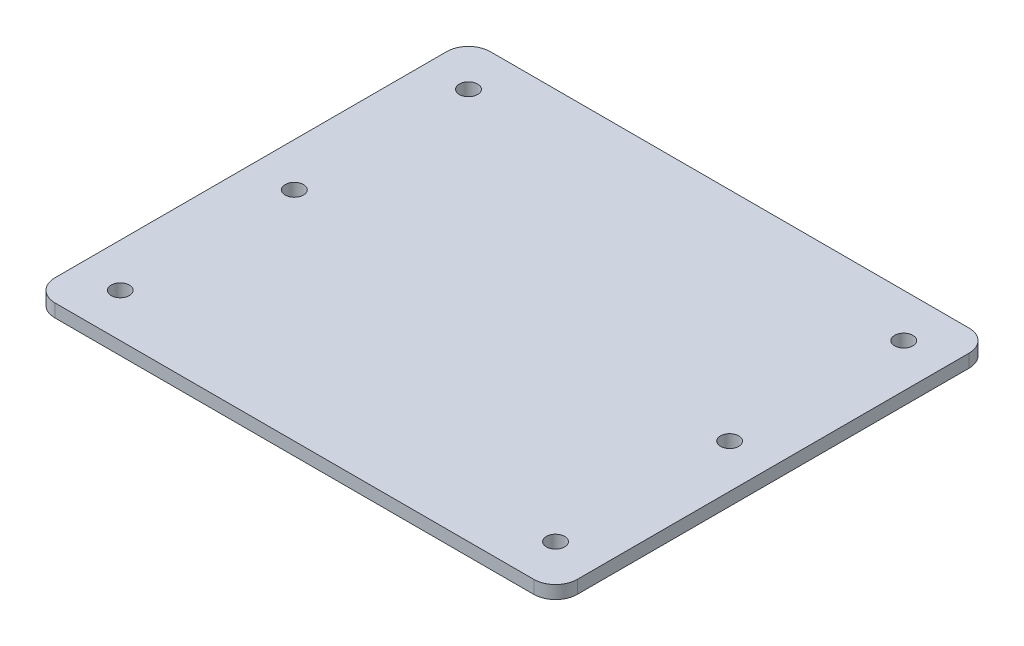
from build123d import *

# Parameters (mm, degrees)
SKETCH_1_W               = 120
SKETCH_1_H               = 100
EXTRUDE_1_DEPTH          = 3
FILLET_1_R               = 5
SKETCH_4_R               = 2.1
CUT_EXTRUDE_2_DEPTH      = 79.160092119
PATTERN_LINEAR_1_COUNT   = 3
PATTERN_LINEAR_1_PITCH   = 40
MIRROR_1_COPY_1_SKETCH_R = 2.1
MIRROR_1_COPY_1_DEPTH    = 79.160092119
MIRROR_1_COPY_2_SKETCH_R = 2.1
MIRROR_1_COPY_2_DEPTH    = 79.160092119


with BuildPart() as part:
    # 草图1 → 凸台-拉伸1 (new body)
    with BuildSketch(Plane(origin=(0, 0, 0), x_dir=(1, 0, 0), z_dir=(0, 1, 0))):
        Rectangle(SKETCH_1_W, SKETCH_1_H)
    extrude(amount=EXTRUDE_1_DEPTH)

    # 圆角1
    fillet_1_edges = [part.edges().sort_by_distance(p)[0] for p in [
        (60, 1.5, 50),
        (-60, 1.5, 50),
        (-60, 1.5, -50),
        (60, 1.5, -50),
    ]]
    fillet(fillet_1_edges, radius=FILLET_1_R)

    # 草图4 → 切除-拉伸2 (cut, through all)
    with BuildSketch(Plane(origin=(0, 3, 0), x_dir=(1, 0, 0), z_dir=(0, 1, 0))):
        with Locations(Location((50, 40, 0), (0, 0, 270))):
            Circle(SKETCH_4_R)
    cut_extrude_2 = extrude(amount=-CUT_EXTRUDE_2_DEPTH, mode=Mode.SUBTRACT)

    # 阵列(线性)1: 切除-拉伸2 ×3
    with Locations(*[(0, 0, i * PATTERN_LINEAR_1_PITCH) for i in range(1, PATTERN_LINEAR_1_COUNT)]):
        add(cut_extrude_2, mode=Mode.SUBTRACT)

    # 镜向1: 切除-拉伸2 across plane
    add(cut_extrude_2.mirror(Plane(origin=(0, 0, 0), x_dir=(0, 0, 1), z_dir=(1, 0, 0))), mode=Mode.SUBTRACT)

    # 镜向1 copy 1 sketch → 镜向1 copy 1 (cut, through all)
    with BuildSketch(Plane(origin=(0, 3, 40), x_dir=(-1, 0, 0), z_dir=(0, 1, 0))):
        with Locations((50, -40)):
            Circle(MIRROR_1_COPY_1_SKETCH_R)
    extrude(amount=-MIRROR_1_COPY_1_DEPTH, mode=Mode.SUBTRACT)

    # 镜向1 copy 2 sketch → 镜向1 copy 2 (cut, through all)
    with BuildSketch(Plane(origin=(0, 3, 80), x_dir=(-1, 0, 0), z_dir=(0, 1, 0))):
        with Locations((50, -40)):
            Circle(MIRROR_1_COPY_2_SKETCH_R)
    extrude(amount=-MIRROR_1_COPY_2_DEPTH, mode=Mode.SUBTRACT)


solid = part.part
